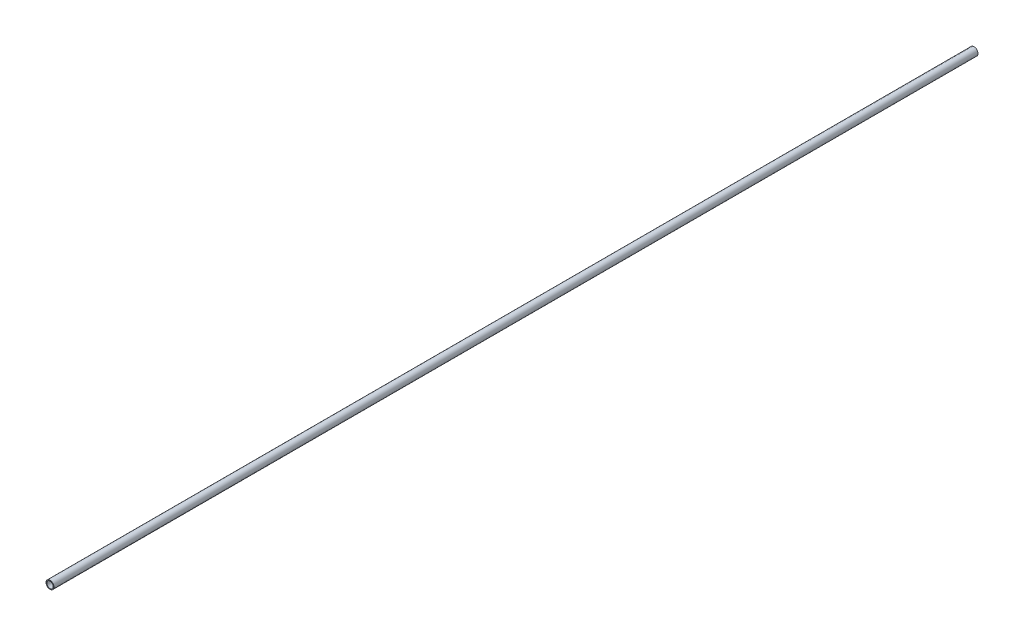
from build123d import *

# Parameters (mm, degrees)
SKETCH1_R           = 7.874
SKETCH1_R_2         = 6.35
BOSS_EXTRUDE1_DEPTH = 1838.452


with BuildPart() as part:
    # Sketch1 → Boss-Extrude1 (new body)
    with BuildSketch(Plane.XY):
        Circle(SKETCH1_R)
        Circle(SKETCH1_R_2, mode=Mode.SUBTRACT)
    extrude(amount=BOSS_EXTRUDE1_DEPTH)


solid = part.part
